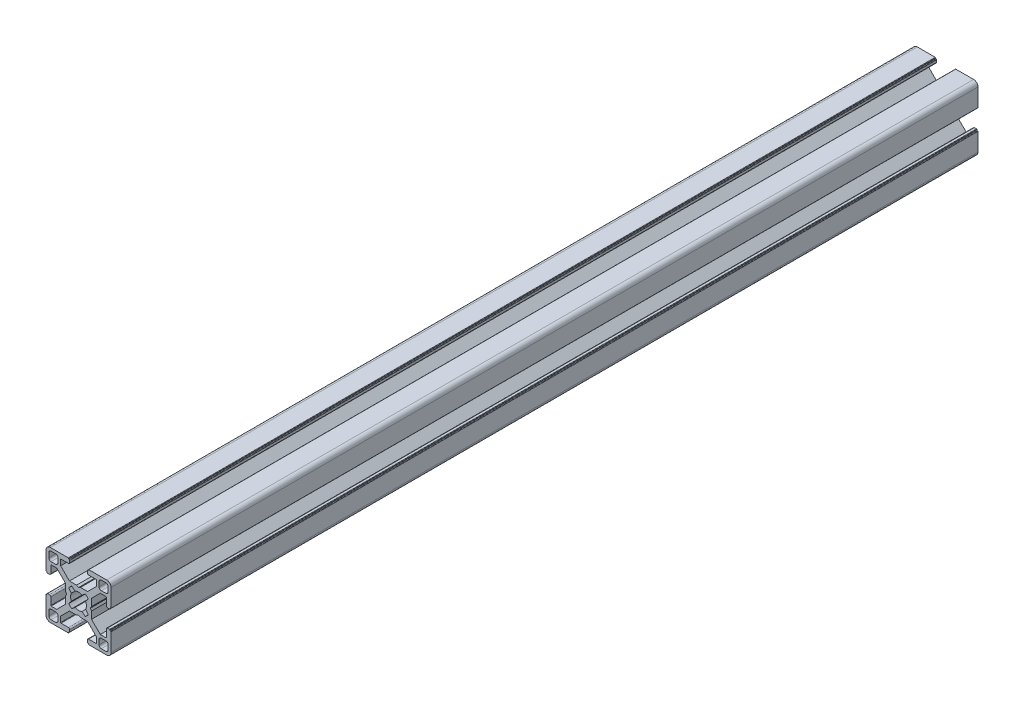
from build123d import *

# Parameters (mm, degrees)
BASE_EXTRUDE_DEPTH = 400


with BuildPart() as part:
    # Sketch1 → Base-Extrude (new body)
    with BuildSketch(Plane.XY):
        with BuildLine():
            Line((6.00446543, 0.899999619), (5.484852164, 0))
            Line((5.484852164, 0), (6.00446543, -0.899999619))
            Line((6.00446543, -0.899999619), (6.00446543, -4.204465866))
            Line((6.00446543, -4.204465866), (10.049999564, -8.25))
            Line((10.049999564, -8.25), (12.59999928, -8.25))
            ThreePointArc((12.59999928, -8.25), (12.741420837, -8.191421273), (12.799999564, -8.049999716))
            Line((12.799999564, -8.049999716), (12.799999564, -4.649999613))
            ThreePointArc((12.799999564, -4.649999613), (12.975735606, -4.225735278), (13.39999994, -4.049999237))
            Line((13.39999994, -4.049999237), (14.300000043, -4.049999237))
            ThreePointArc((14.300000043, -4.049999237), (14.4414216, -4.108577964), (14.500000327, -4.249999521))
            Line((14.500000327, -4.249999521), (14.500000327, -4.349998953))
            ThreePointArc((14.500000327, -4.349998953), (14.558579054, -4.49142051), (14.700000611, -4.549999237))
            Line((14.700000611, -4.549999237), (14.799999716, -4.549999237))
            ThreePointArc((14.799999716, -4.549999237), (14.941421273, -4.608577964), (15, -4.749999521))
            Line((15, -4.749999521), (15, -13.000000346))
            ThreePointArc((15, -13.000000346), (14.414213664, -14.414213664), (13.000000346, -15))
            Line((13.000000346, -15), (4.749999945, -15))
            ThreePointArc((4.749999945, -15), (4.60857832, -14.941421245), (4.549999564, -14.799999619))
            Line((4.549999564, -14.799999619), (4.549999564, -14.69999942))
            ThreePointArc((4.549999564, -14.69999942), (4.49142109, -14.558578474), (4.350000144, -14.5))
            Line((4.350000144, -14.5), (4.250000374, -14.5))
            ThreePointArc((4.250000374, -14.5), (4.108578753, -14.441421247), (4.05, -14.299999626))
            Line((4.05, -14.299999626), (4.05, -13.399999434))
            ThreePointArc((4.05, -13.399999434), (4.225735989, -12.975735226), (4.650000197, -12.799999237))
            Line((4.650000197, -12.799999237), (8.049999924, -12.799999237))
            ThreePointArc((8.049999924, -12.799999237), (8.191421565, -12.741420475), (8.250000327, -12.599998834))
            Line((8.250000327, -12.599998834), (8.250000327, -10.049999237))
            Line((8.250000327, -10.049999237), (4.204466193, -6))
            Line((4.204466193, -6), (0.899999946, -6))
            Line((0.899999946, -6), (0, -5.484851837))
            Line((0, -5.484851837), (-0.899999946, -6))
            Line((-0.899999946, -6), (-4.204466193, -6))
            Line((-4.204466193, -6), (-8.250000327, -10.049999237))
            Line((-8.250000327, -10.049999237), (-8.250000327, -12.599998834))
            ThreePointArc((-8.250000327, -12.599998834), (-8.191421565, -12.741420475), (-8.049999924, -12.799999237))
            Line((-8.049999924, -12.799999237), (-4.650000197, -12.799999237))
            ThreePointArc((-4.650000197, -12.799999237), (-4.225735989, -12.975735226), (-4.05, -13.399999434))
            Line((-4.05, -13.399999434), (-4.05, -14.299999626))
            ThreePointArc((-4.05, -14.299999626), (-4.108578753, -14.441421247), (-4.250000374, -14.5))
            Line((-4.250000374, -14.5), (-4.350000144, -14.5))
            ThreePointArc((-4.350000144, -14.5), (-4.49142109, -14.558578474), (-4.549999564, -14.69999942))
            Line((-4.549999564, -14.69999942), (-4.549999564, -14.799999619))
            ThreePointArc((-4.549999564, -14.799999619), (-4.60857832, -14.941421245), (-4.749999945, -15))
            Line((-4.749999945, -15), (-13.000000346, -15))
            ThreePointArc((-13.000000346, -15), (-14.414213664, -14.414213664), (-15, -13.000000346))
            Line((-15, -13.000000346), (-15, -4.749999521))
            ThreePointArc((-15, -4.749999521), (-14.941421273, -4.608577964), (-14.799999716, -4.549999237))
            Line((-14.799999716, -4.549999237), (-14.700000611, -4.549999237))
            ThreePointArc((-14.700000611, -4.549999237), (-14.558579054, -4.49142051), (-14.500000327, -4.349998953))
            Line((-14.500000327, -4.349998953), (-14.500000327, -4.249999521))
            ThreePointArc((-14.500000327, -4.249999521), (-14.4414216, -4.108577964), (-14.300000043, -4.049999237))
            Line((-14.300000043, -4.049999237), (-13.39999994, -4.049999237))
            ThreePointArc((-13.39999994, -4.049999237), (-12.975735606, -4.225735278), (-12.799999564, -4.649999613))
            Line((-12.799999564, -4.649999613), (-12.799999564, -8.049999716))
            ThreePointArc((-12.799999564, -8.049999716), (-12.741420837, -8.191421273), (-12.59999928, -8.25))
            Line((-12.59999928, -8.25), (-10.049999564, -8.25))
            Line((-10.049999564, -8.25), (-6.00446543, -4.204465866))
            Line((-6.00446543, -4.204465866), (-6.00446543, -0.899999619))
            Line((-6.00446543, -0.899999619), (-5.484852164, 0))
            Line((-5.484852164, 0), (-6.00446543, 0.899999619))
            Line((-6.00446543, 0.899999619), (-6.00446543, 4.204465866))
            Line((-6.00446543, 4.204465866), (-10.049999564, 8.25))
            Line((-10.049999564, 8.25), (-12.59999928, 8.25))
            ThreePointArc((-12.59999928, 8.25), (-12.741420837, 8.191421273), (-12.799999564, 8.049999716))
            Line((-12.799999564, 8.049999716), (-12.799999564, 4.649999613))
            ThreePointArc((-12.799999564, 4.649999613), (-12.975735606, 4.225735278), (-13.39999994, 4.049999237))
            Line((-13.39999994, 4.049999237), (-14.300000043, 4.049999237))
            ThreePointArc((-14.300000043, 4.049999237), (-14.4414216, 4.108577964), (-14.500000327, 4.249999521))
            Line((-14.500000327, 4.249999521), (-14.500000327, 4.349998953))
            ThreePointArc((-14.500000327, 4.349998953), (-14.558579054, 4.49142051), (-14.700000611, 4.549999237))
            Line((-14.700000611, 4.549999237), (-14.799999716, 4.549999237))
            ThreePointArc((-14.799999716, 4.549999237), (-14.941421273, 4.608577964), (-15, 4.749999521))
            Line((-15, 4.749999521), (-15, 13.000000346))
            ThreePointArc((-15, 13.000000346), (-14.414213664, 14.414213664), (-13.000000346, 15))
            Line((-13.000000346, 15), (-4.749999945, 15))
            ThreePointArc((-4.749999945, 15), (-4.60857832, 14.941421245), (-4.549999564, 14.799999619))
            Line((-4.549999564, 14.799999619), (-4.549999564, 14.69999942))
            ThreePointArc((-4.549999564, 14.69999942), (-4.49142109, 14.558578474), (-4.350000144, 14.5))
            Line((-4.350000144, 14.5), (-4.250000374, 14.5))
            ThreePointArc((-4.250000374, 14.5), (-4.108578753, 14.441421247), (-4.05, 14.299999626))
            Line((-4.05, 14.299999626), (-4.05, 13.399999434))
            ThreePointArc((-4.05, 13.399999434), (-4.225735989, 12.975735226), (-4.650000197, 12.799999237))
            Line((-4.650000197, 12.799999237), (-8.049999924, 12.799999237))
            ThreePointArc((-8.049999924, 12.799999237), (-8.191421565, 12.741420475), (-8.250000327, 12.599998834))
            Line((-8.250000327, 12.599998834), (-8.250000327, 10.049999237))
            Line((-8.250000327, 10.049999237), (-4.204466193, 6))
            Line((-4.204466193, 6), (-0.899999946, 6))
            Line((-0.899999946, 6), (0, 5.484851837))
            Line((0, 5.484851837), (0.899999946, 6))
            Line((0.899999946, 6), (4.204466193, 6))
            Line((4.204466193, 6), (8.250000327, 10.049999237))
            Line((8.250000327, 10.049999237), (8.250000327, 12.599998834))
            ThreePointArc((8.250000327, 12.599998834), (8.191421565, 12.741420475), (8.049999924, 12.799999237))
            Line((8.049999924, 12.799999237), (4.650000197, 12.799999237))
            ThreePointArc((4.650000197, 12.799999237), (4.225735989, 12.975735226), (4.05, 13.399999434))
            Line((4.05, 13.399999434), (4.05, 14.299999626))
            ThreePointArc((4.05, 14.299999626), (4.108578753, 14.441421247), (4.250000374, 14.5))
            Line((4.250000374, 14.5), (4.350000144, 14.5))
            ThreePointArc((4.350000144, 14.5), (4.49142109, 14.558578474), (4.549999564, 14.69999942))
            Line((4.549999564, 14.69999942), (4.549999564, 14.799999619))
            ThreePointArc((4.549999564, 14.799999619), (4.60857832, 14.941421245), (4.749999945, 15))
            Line((4.749999945, 15), (13.000000346, 15))
            ThreePointArc((13.000000346, 15), (14.414213664, 14.414213664), (15, 13.000000346))
            Line((15, 13.000000346), (15, 4.749999521))
            ThreePointArc((15, 4.749999521), (14.941421273, 4.608577964), (14.799999716, 4.549999237))
            Line((14.799999716, 4.549999237), (14.700000611, 4.549999237))
            ThreePointArc((14.700000611, 4.549999237), (14.558579054, 4.49142051), (14.500000327, 4.349998953))
            Line((14.500000327, 4.349998953), (14.500000327, 4.249999521))
            ThreePointArc((14.500000327, 4.249999521), (14.4414216, 4.108577964), (14.300000043, 4.049999237))
            Line((14.300000043, 4.049999237), (13.39999994, 4.049999237))
            ThreePointArc((13.39999994, 4.049999237), (12.975735606, 4.225735278), (12.799999564, 4.649999613))
            Line((12.799999564, 4.649999613), (12.799999564, 8.049999716))
            ThreePointArc((12.799999564, 8.049999716), (12.741420837, 8.191421273), (12.59999928, 8.25))
            Line((12.59999928, 8.25), (10.049999564, 8.25))
            Line((10.049999564, 8.25), (6.00446543, 4.204465866))
            Line((6.00446543, 4.204465866), (6.00446543, 0.899999619))
        make_face()
        with BuildLine():
            Line((13.70000109, 12.700000398), (13.70000109, 10.499999635))
            ThreePointArc((13.70000109, 10.499999635), (13.407107874, 9.792892851), (12.70000109, 9.499999635))
            Line((12.70000109, 9.499999635), (10.500000327, 9.499999635))
            ThreePointArc((10.500000327, 9.499999635), (9.792893543, 9.792892851), (9.500000327, 10.499999635))
            Line((9.500000327, 10.499999635), (9.500000327, 12.700000398))
            ThreePointArc((9.500000327, 12.700000398), (9.792893543, 13.407107182), (10.500000327, 13.700000398))
            Line((10.500000327, 13.700000398), (12.70000109, 13.700000398))
            ThreePointArc((12.70000109, 13.700000398), (13.407107874, 13.407107182), (13.70000109, 12.700000398))
        make_face(mode=Mode.SUBTRACT)
        with BuildLine():
            Line((3.135929412, 4.518400903), (1.600129524, 3.280561767))
            ThreePointArc((1.600129524, 3.280561767), (0, 3.65), (-1.600129524, 3.280561767))
            Line((-1.600129524, 3.280561767), (-3.135929412, 4.518400903))
            ThreePointArc((-3.135929412, 4.518400903), (-3.881002259, 3.897155561), (-4.505336892, 3.154669473))
            Line((-4.505336892, 3.154669473), (-3.280561732, 1.600129597))
            ThreePointArc((-3.280561732, 1.600129597), (-3.65, 0), (-3.280561732, -1.600129597))
            Line((-3.280561732, -1.600129597), (-4.505336892, -3.154669473))
            ThreePointArc((-4.505336892, -3.154669473), (-3.881002259, -3.897155561), (-3.135929412, -4.518400903))
            Line((-3.135929412, -4.518400903), (-1.600129524, -3.280561767))
            ThreePointArc((-1.600129524, -3.280561767), (0, -3.65), (1.600129524, -3.280561767))
            Line((1.600129524, -3.280561767), (3.135929412, -4.518400903))
            ThreePointArc((3.135929412, -4.518400903), (3.881002259, -3.897155561), (4.505336892, -3.154669473))
            Line((4.505336892, -3.154669473), (3.280561732, -1.600129597))
            ThreePointArc((3.280561732, -1.600129597), (3.65, 0), (3.280561732, 1.600129597))
            Line((3.280561732, 1.600129597), (4.505336892, 3.154669473))
            ThreePointArc((4.505336892, 3.154669473), (3.881002259, 3.897155561), (3.135929412, 4.518400903))
        make_face(mode=Mode.SUBTRACT)
        with BuildLine():
            Line((-13.70000109, -12.700000398), (-13.70000109, -10.499999635))
            ThreePointArc((-13.70000109, -10.499999635), (-13.407107874, -9.792892851), (-12.70000109, -9.499999635))
            Line((-12.70000109, -9.499999635), (-10.500000327, -9.499999635))
            ThreePointArc((-10.500000327, -9.499999635), (-9.792893543, -9.792892851), (-9.500000327, -10.499999635))
            Line((-9.500000327, -10.499999635), (-9.500000327, -12.700000398))
            ThreePointArc((-9.500000327, -12.700000398), (-9.792893543, -13.407107182), (-10.500000327, -13.700000398))
            Line((-10.500000327, -13.700000398), (-12.70000109, -13.700000398))
            ThreePointArc((-12.70000109, -13.700000398), (-13.407107874, -13.407107182), (-13.70000109, -12.700000398))
        make_face(mode=Mode.SUBTRACT)
        with BuildLine():
            Line((10.500000327, -13.700000398), (12.70000109, -13.700000398))
            ThreePointArc((12.70000109, -13.700000398), (13.407107874, -13.407107182), (13.70000109, -12.700000398))
            Line((13.70000109, -12.700000398), (13.70000109, -10.499999635))
            ThreePointArc((13.70000109, -10.499999635), (13.407107874, -9.792892851), (12.70000109, -9.499999635))
            Line((12.70000109, -9.499999635), (10.500000327, -9.499999635))
            ThreePointArc((10.500000327, -9.499999635), (9.792893543, -9.792892851), (9.500000327, -10.499999635))
            Line((9.500000327, -10.499999635), (9.500000327, -12.700000398))
            ThreePointArc((9.500000327, -12.700000398), (9.792893543, -13.407107182), (10.500000327, -13.700000398))
        make_face(mode=Mode.SUBTRACT)
        with BuildLine():
            Line((-10.500000327, 13.700000398), (-12.70000109, 13.700000398))
            ThreePointArc((-12.70000109, 13.700000398), (-13.407107874, 13.407107182), (-13.70000109, 12.700000398))
            Line((-13.70000109, 12.700000398), (-13.70000109, 10.499999635))
            ThreePointArc((-13.70000109, 10.499999635), (-13.407107874, 9.792892851), (-12.70000109, 9.499999635))
            Line((-12.70000109, 9.499999635), (-10.500000327, 9.499999635))
            ThreePointArc((-10.500000327, 9.499999635), (-9.792893543, 9.792892851), (-9.500000327, 10.499999635))
            Line((-9.500000327, 10.499999635), (-9.500000327, 12.700000398))
            ThreePointArc((-9.500000327, 12.700000398), (-9.792893543, 13.407107182), (-10.500000327, 13.700000398))
        make_face(mode=Mode.SUBTRACT)
    extrude(amount=-BASE_EXTRUDE_DEPTH)


solid = part.part
